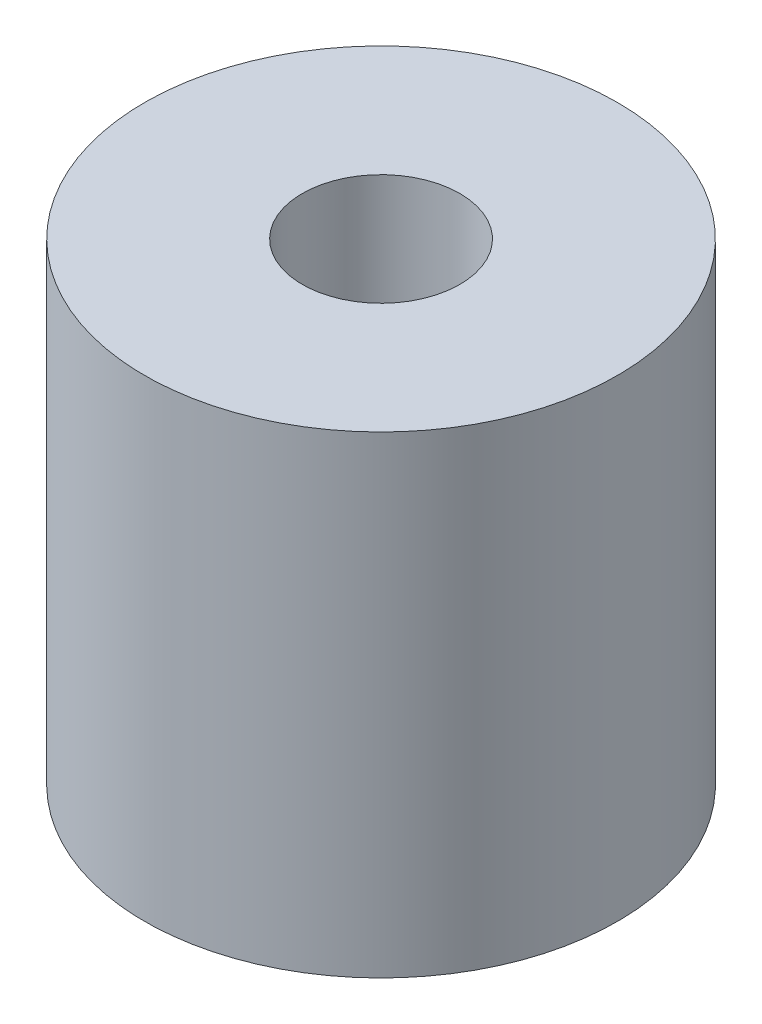
from build123d import *

# Parameters (mm, degrees)
SKETCH1_W = 20
SKETCH1_H = 60


with BuildPart() as part:
    # Sketch1 → Revolve1 (revolve)
    with BuildSketch(Plane.XY, mode=Mode.PRIVATE) as revolve1_sk:
        with Locations((20, 0)):
            Rectangle(SKETCH1_W, SKETCH1_H)
    revolve(revolve1_sk.sketch.rotate(Axis((0, -40, 0), (0, 1, 0)), 90), axis=Axis((0, -40, 0), (0, 1, 0)))


solid = part.part
